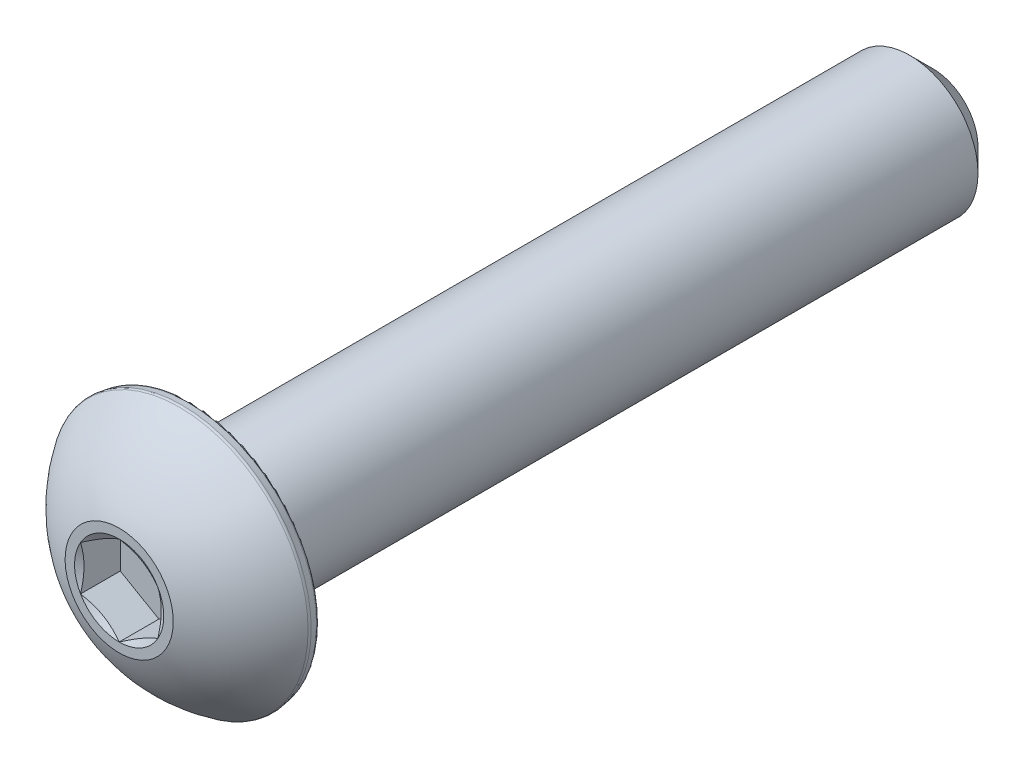
from build123d import *

# Parameters (mm, degrees)
CUT_EXTRUDE1_DEPTH = 1.01981
FILLET1_R          = 0.09271


with BuildPart() as part:
    # Sketch3 → Revolve1 (revolve)
    with BuildSketch(Plane(origin=(0, 0, 0), x_dir=(0, 0, -1), z_dir=(1, 0, 0)), mode=Mode.PRIVATE) as revolve1_sk:
        with BuildLine():
            Line((-10.4521, 0), (-10.4521, 1.3890625))
            ThreePointArc((-10.4521, 1.3890625), (-9.821710995, 2.486413841), (-8.87603, 3.3274))
            Line((-8.87603, 3.3274), (-8.5979, 3.278358177))
            Line((-8.5979, 3.278358177), (-8.5979, 1.7526))
            Line((-8.5979, 1.7526), (9.8567875, 1.7526))
            Line((9.8567875, 1.7526), (10.4521, 1.1572875))
            Line((10.4521, 1.1572875), (10.4521, 0))
            Line((10.4521, 0), (-10.4521, 0))
        make_face()
    revolve(revolve1_sk.sketch.rotate(Axis((0, 0, 10.4521), (0, 0, -1)), 90), axis=Axis((0, 0, 10.4521), (0, 0, -1)))

    # Sketch4 → Cut-Extrude1 (cut)
    with BuildSketch(Plane.XY.offset(10.4521)):
        Polygon((-0.9921875, -0.57283972), (0, -1.14567944), (0.9921875, -0.57283972), (0.9921875, 0.57283972), (0, 1.14567944), (-0.9921875, 0.57283972), align=None)
    extrude(amount=-CUT_EXTRUDE1_DEPTH, mode=Mode.SUBTRACT)

    # Cut-Extrude2 cone 1 section (through the dimple's axis) → Cut-Extrude2 (revolve, cut)
    with BuildSketch(Plane(origin=(0, 0, 10.4521), x_dir=(0, -1, 0), z_dir=(1, 0, 0))):
        Polygon((0, 0), (1.14567944, 0), (0, 0.661458333), align=None)
    revolve(axis=Axis((0, 0, 10.4521), (0, 0, -1)), mode=Mode.SUBTRACT)

    # Fillet1
    fillet1_edges = [part.edges().sort_by_distance(p)[0] for p in [
        (-3.278358177, 0, 8.5979),
        (-3.3274, 0, 8.87603),
    ]]
    fillet(fillet1_edges, radius=FILLET1_R)


solid = part.part
